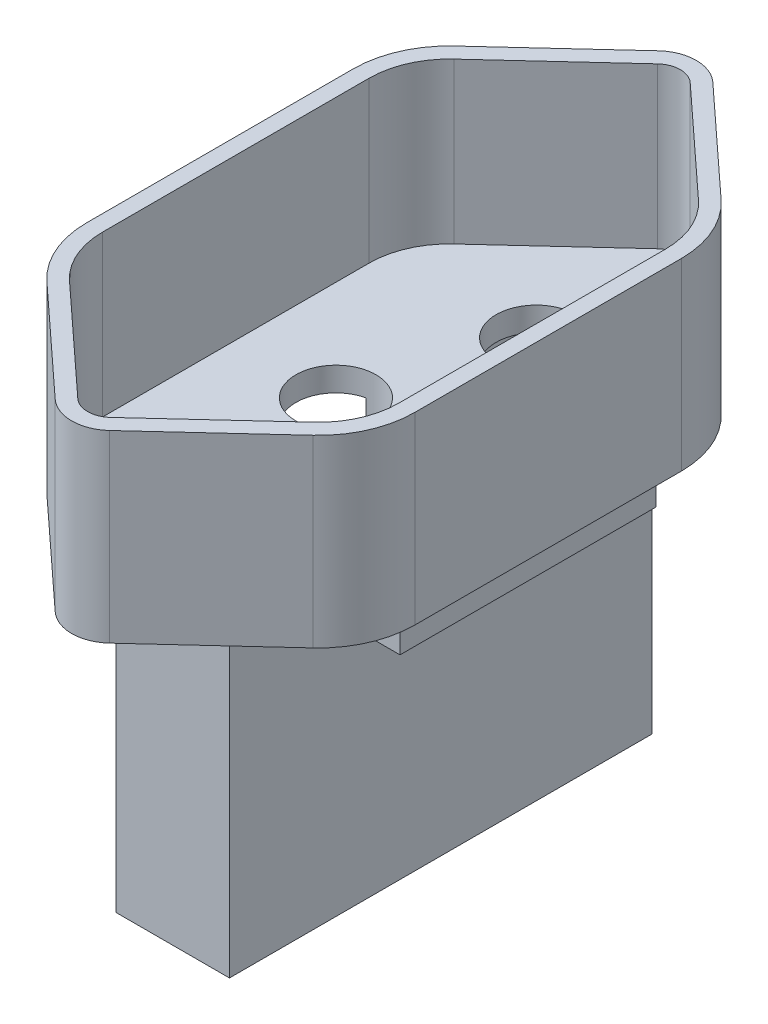
from build123d import *

# Parameters (mm, degrees)
ESBO_O1_W                = 26.7
ESBO_O1_H                = 39.3
RESSALTO_EXTRUS_O1_DEPTH = 38.5
CORTE_EXTRUS_O1_DEPTH    = 10
ESBO_O4_W                = 26.7
ESBO_O4_H                = 39.3
CORTE_EXTRUS_O2_DEPTH    = 10
ESBO_O5_W                = 26.7
ESBO_O5_H                = 39.3
ESBO_O5_W_2              = 22.6
ESBO_O5_H_2              = 27
CORTE_EXTRUS_O4_DEPTH    = 27
ESBO_O6_R                = 2.5
CORTE_EXTRUS_O5_DEPTH    = 5
ESBO_O7_W                = 2.05
ESBO_O7_H                = 1
RESSALTO_EXTRUS_O2_DEPTH = 4
CUT_EXTRUDE1_DEPTH       = 10
CUT_EXTRUDE1_DEPTH_BACK  = 100
SKETCH2_W                = 27
SKETCH2_H                = 27
ESBO_O4_3_W              = 26.7
ESBO_O4_3_H              = 39.3
CUT_EXTRUDE3_DEPTH       = 100
BOSS_EXTRUDE1_DEPTH      = 20
SKETCH6_3_W              = 5.45
SKETCH6_3_H              = 16
SKETCH6_3_R              = 1
BOSS_EXTRUDE2_DEPTH      = 2.4


with BuildPart() as part:
    # Esboço1 → Ressalto-extrusão1 (new body)
    with BuildSketch(Plane(origin=(0, 0, 0), x_dir=(1, 0, 0), z_dir=(0, 1, 0))):
        Rectangle(ESBO_O1_W, ESBO_O1_H)
    extrude(amount=-RESSALTO_EXTRUS_O1_DEPTH)

    # Esboço2 → Corte-extrusão1 (cut)
    with BuildSketch(Plane(origin=(0, 0, 0), x_dir=(1, 0, 0), z_dir=(0, 1, 0))):
        with BuildLine():
            Line((1.016622231, -18.102941176), (7.638740771, -11.999086257))
            ThreePointArc((7.638740771, -11.999086257), (8.829503459, -10.32964035), (9.25, -8.322615669))
            Line((9.25, -8.322615669), (9.25, 8.322615669))
            ThreePointArc((9.25, 8.322615669), (8.829503459, 10.32964035), (7.638740771, 11.999086257))
            Line((7.638740771, 11.999086257), (1.016622231, 18.102941176))
            ThreePointArc((1.016622231, 18.102941176), (0, 18.5), (-1.016622231, 18.102941176))
            Line((-1.016622231, 18.102941176), (-7.638740771, 11.999086257))
            ThreePointArc((-7.638740771, 11.999086257), (-8.829503459, 10.32964035), (-9.25, 8.322615669))
            Line((-9.25, 8.322615669), (-9.25, -8.322615669))
            ThreePointArc((-9.25, -8.322615669), (-8.829503459, -10.32964035), (-7.638740771, -11.999086257))
            Line((-7.638740771, -11.999086257), (-1.016622231, -18.102941176))
            ThreePointArc((-1.016622231, -18.102941176), (0, -18.5), (1.016622231, -18.102941176))
        make_face()
    extrude(amount=-CORTE_EXTRUS_O1_DEPTH, mode=Mode.SUBTRACT)

    # Esboço4 → Corte-extrusão2 (cut)
    with BuildSketch(Plane(origin=(0, 0, 0), x_dir=(1, 0, 0), z_dir=(0, 1, 0))):
        Rectangle(ESBO_O4_W, ESBO_O4_H)
        with BuildLine():
            Line((-1.694370386, -18.838235294), (-8.316488925, -12.734380374))
            ThreePointArc((-8.316488925, -12.734380374), (-9.74540415, -10.731045286), (-10.25, -8.322615669))
            Line((-10.25, -8.322615669), (-10.25, 8.322615669))
            ThreePointArc((-10.25, 8.322615669), (-9.74540415, 10.731045286), (-8.316488925, 12.734380374))
            Line((-8.316488925, 12.734380374), (-1.694370386, 18.838235294))
            ThreePointArc((-1.694370386, 18.838235294), (0, 19.5), (1.694370386, 18.838235294))
            Line((1.694370386, 18.838235294), (8.316488925, 12.734380374))
            ThreePointArc((8.316488925, 12.734380374), (9.74540415, 10.731045286), (10.25, 8.322615669))
            Line((10.25, 8.322615669), (10.25, -8.322615669))
            ThreePointArc((10.25, -8.322615669), (9.74540415, -10.731045286), (8.316488925, -12.734380374))
            Line((8.316488925, -12.734380374), (1.694370386, -18.838235294))
            ThreePointArc((1.694370386, -18.838235294), (0, -19.5), (-1.694370386, -18.838235294))
        make_face(mode=Mode.SUBTRACT)
    extrude(amount=-CORTE_EXTRUS_O2_DEPTH, mode=Mode.SUBTRACT)

    # Esboço5 → Corte-extrusão4 (cut)
    with BuildSketch(Plane.XZ.offset(38.5)):
        Rectangle(ESBO_O5_W, ESBO_O5_H)
        Rectangle(ESBO_O5_W_2, ESBO_O5_H_2, mode=Mode.SUBTRACT)
    extrude(amount=-CORTE_EXTRUS_O4_DEPTH, mode=Mode.SUBTRACT)

    # Esboço6 → Corte-extrusão5 (cut)
    with BuildSketch(Plane(origin=(0, -10, 0), x_dir=(1, 0, 0), z_dir=(0, 1, 0))):
        with Locations((0, -9.5)):
            Circle(ESBO_O6_R)
        with Locations((0, 9.5)):
            Circle(ESBO_O6_R)
        with Locations((-3, 0)):
            Circle(ESBO_O6_R)
    extrude(amount=-CORTE_EXTRUS_O5_DEPTH, mode=Mode.SUBTRACT)

    # Esboço7 → Ressalto-extrusão2 (add)
    with BuildSketch(Plane.XZ.offset(11.5)):
        with Locations((12.325, 13)):
            Rectangle(ESBO_O7_W, ESBO_O7_H)
        with Locations((-12.325, 13)):
            Rectangle(ESBO_O7_W, ESBO_O7_H)
        with Locations((-12.325, -13)):
            Rectangle(ESBO_O7_W, ESBO_O7_H)
        with Locations((12.325, -13)):
            Rectangle(ESBO_O7_W, ESBO_O7_H)
    extrude(amount=RESSALTO_EXTRUS_O2_DEPTH)

    # Sketch2 → Cut-Extrude1 (cut, two sides: drawn at the far end of the back side and taken through both)
    with BuildSketch(Plane(origin=(11.3, 0, 0), x_dir=(0, 0, -1), z_dir=(1, 0, 0)).offset(-CUT_EXTRUDE1_DEPTH_BACK)):
        with Locations((0, -25)):
            Rectangle(SKETCH2_W, SKETCH2_H)
    extrude(amount=CUT_EXTRUDE1_DEPTH + CUT_EXTRUDE1_DEPTH_BACK, mode=Mode.SUBTRACT)

    # Esboço4<3> → Cut-Extrude3 (cut)
    with BuildSketch(Plane(origin=(0, 0, 0), x_dir=(1, 0, 0), z_dir=(0, 1, 0))):
        Rectangle(ESBO_O4_3_W, ESBO_O4_3_H)
        with BuildLine():
            Line((-1.694370386, -18.838235294), (-8.316488925, -12.734380374))
            ThreePointArc((-8.316488925, -12.734380374), (-9.74540415, -10.731045286), (-10.25, -8.322615669))
            Line((-10.25, -8.322615669), (-10.25, 8.322615669))
            ThreePointArc((-10.25, 8.322615669), (-9.74540415, 10.731045286), (-8.316488925, 12.734380374))
            Line((-8.316488925, 12.734380374), (-1.694370386, 18.838235294))
            ThreePointArc((-1.694370386, 18.838235294), (0, 19.5), (1.694370386, 18.838235294))
            Line((1.694370386, 18.838235294), (8.316488925, 12.734380374))
            ThreePointArc((8.316488925, 12.734380374), (9.74540415, 10.731045286), (10.25, 8.322615669))
            Line((10.25, 8.322615669), (10.25, -8.322615669))
            ThreePointArc((10.25, -8.322615669), (9.74540415, -10.731045286), (8.316488925, -12.734380374))
            Line((8.316488925, -12.734380374), (1.694370386, -18.838235294))
            ThreePointArc((1.694370386, -18.838235294), (0, -19.5), (-1.694370386, -18.838235294))
        make_face(mode=Mode.SUBTRACT)
    extrude(amount=-CUT_EXTRUDE3_DEPTH, mode=Mode.SUBTRACT)

    # Sketch6 → Boss-Extrude1 (add)
    with BuildSketch(Plane.XZ.offset(11.5)):
        with BuildLine():
            Line((-3.55, 13.2), (-3.55, 2.43874968))
            ThreePointArc((-3.55, 2.43874968), (-1.4387505, 1.952562419), (-0.5, 0))
            ThreePointArc((-0.5, 0), (-1.4387505, -1.952562419), (-3.55, -2.43874968))
            Line((-3.55, -2.43874968), (-3.55, -13.2))
            Line((-3.55, -13.2), (3.55, -13.2))
            Line((3.55, -13.2), (3.55, -8))
            Line((3.55, -8), (3.55, 8))
            Line((3.55, 8), (3.55, 13.2))
            Line((3.55, 13.2), (-3.55, 13.2))
        make_face()
        with BuildLine():
            Line((2.75, -12.4), (-2.75, -12.4))
            Line((-2.75, -12.4), (-2.75, -3.290516677))
            ThreePointArc((-2.75, -3.290516677), (-0.720448476, -2.386135967), (0.275667871, -0.4))
            Line((0.275667871, -0.4), (2.75, -0.4))
            Line((2.75, -0.4), (2.75, -12.4))
        make_face(mode=Mode.SUBTRACT)
        with BuildLine():
            Line((2.75, 12.4), (2.75, 0.4))
            Line((2.75, 0.4), (0.275667871, 0.4))
            ThreePointArc((0.275667871, 0.4), (-0.720448476, 2.386135967), (-2.75, 3.290516677))
            Line((-2.75, 3.290516677), (-2.75, 12.4))
            Line((-2.75, 12.4), (2.75, 12.4))
        make_face(mode=Mode.SUBTRACT)
    extrude(amount=BOSS_EXTRUDE1_DEPTH)

    # Sketch6<3> → Boss-Extrude2 (add)
    with BuildSketch(Plane.XZ.offset(11.5)):
        with Locations((6.275, 0)):
            Rectangle(SKETCH6_3_W, SKETCH6_3_H)
        with Locations((7, -5.75)):
            Circle(SKETCH6_3_R, mode=Mode.SUBTRACT)
        with Locations((7, 5.75)):
            Circle(SKETCH6_3_R, mode=Mode.SUBTRACT)
    extrude(amount=BOSS_EXTRUDE2_DEPTH)


solid = part.part
